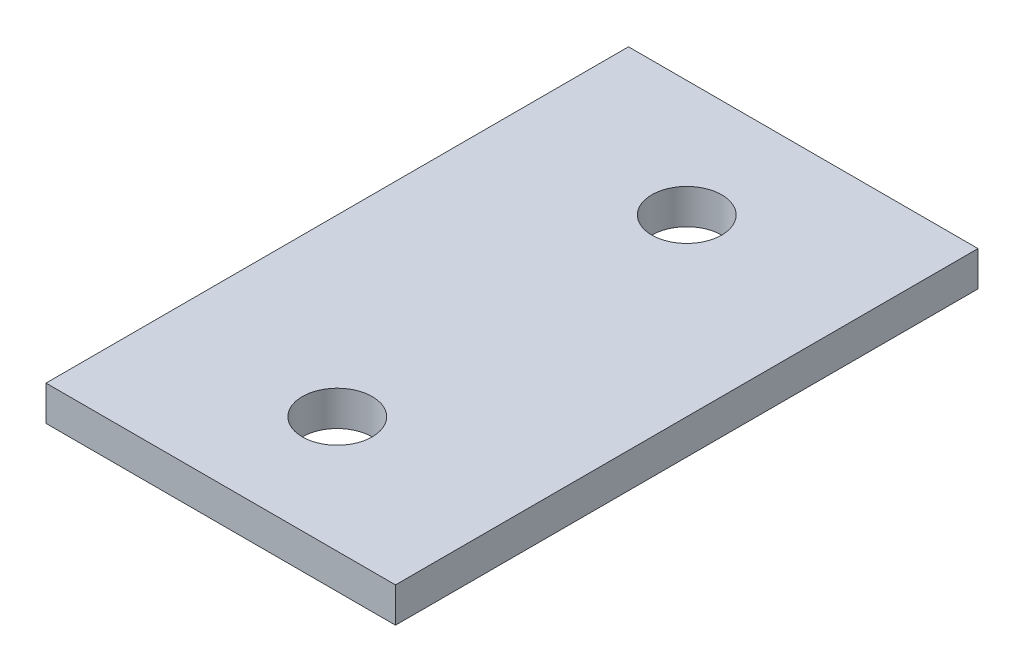
from build123d import *

# Parameters (mm, degrees)
CROQUIS1_W              = 15
CROQUIS1_H              = 25
SALIENTE_EXTRUIR2_DEPTH = 2
CROQUIS2_R              = 1.5
CORTAR_EXTRUIR1_DEPTH   = 2
CROQUIS3_W              = 26.611189866
CROQUIS3_H              = 39.098747884
CORTAR_EXTRUIR2_DEPTH   = 0.5


with BuildPart() as part:
    # Croquis1 → Saliente-Extruir2 (new body)
    with BuildSketch(Plane(origin=(0, 0, 0), x_dir=(1, 0, 0), z_dir=(0, 1, 0))):
        Rectangle(CROQUIS1_W, CROQUIS1_H)
    extrude(amount=SALIENTE_EXTRUIR2_DEPTH)

    # Croquis2 → Cortar-Extruir1 (cut)
    with BuildSketch(Plane(origin=(0, 2, 0), x_dir=(1, 0, 0), z_dir=(0, 1, 0))):
        with Locations(Location((0, 7.5, 0), (0, 0, 270))):
            Circle(CROQUIS2_R)
        with Locations(Location((0, -7.5, 0), (0, 0, 270))):
            Circle(CROQUIS2_R)
    extrude(amount=-CORTAR_EXTRUIR1_DEPTH, mode=Mode.SUBTRACT)

    # Croquis3 → Cortar-Extruir2 (cut)
    with BuildSketch(Plane(origin=(0, 2, 0), x_dir=(1, 0, 0), z_dir=(0, 1, 0))):
        Rectangle(CROQUIS3_W, CROQUIS3_H)
    extrude(amount=-CORTAR_EXTRUIR2_DEPTH, mode=Mode.SUBTRACT)


solid = part.part
